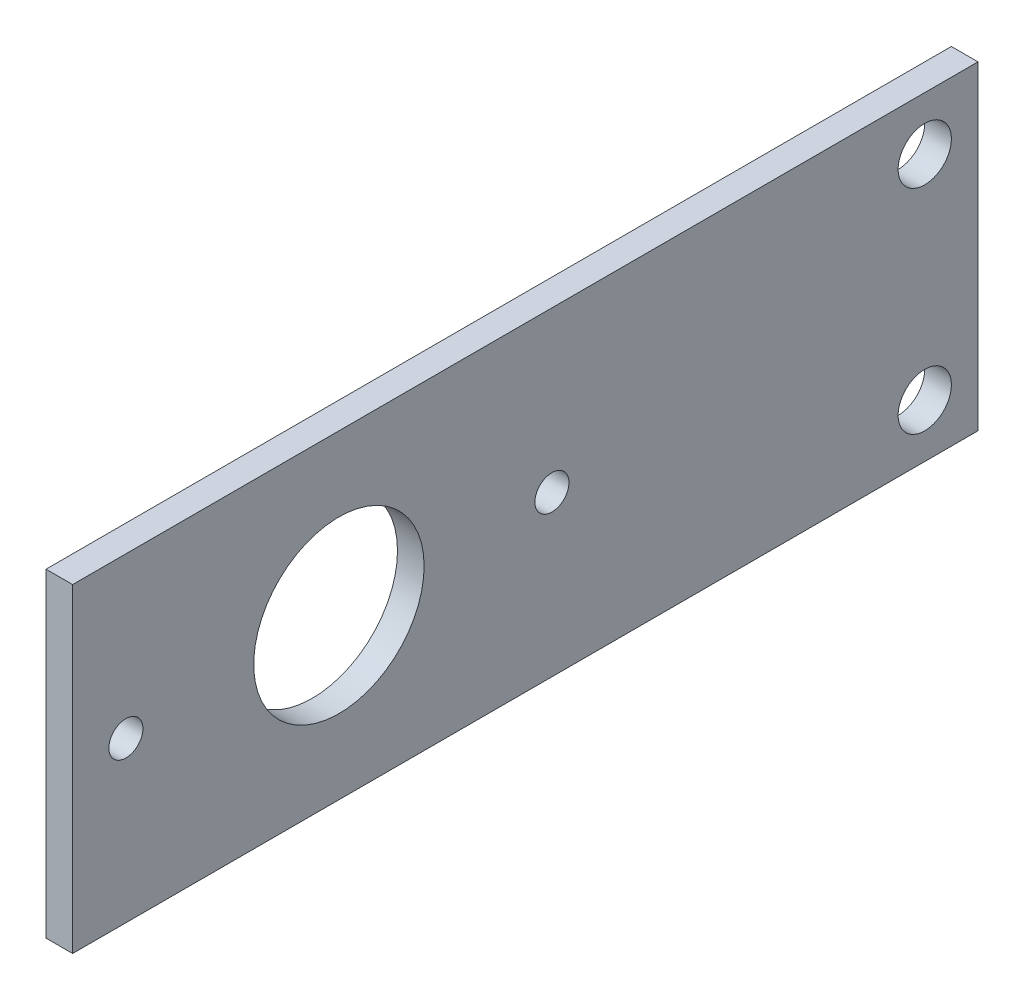
from build123d import *

# Parameters (mm, degrees)
SKETCH1_W           = 107.95
SKETCH1_H           = 38.1
SKETCH1_R           = 3.175
SKETCH1_R_2         = 2.032
SKETCH1_R_3         = 10.16
BOSS_EXTRUDE1_DEPTH = 3.175


with BuildPart() as part:
    # Sketch1 → Boss-Extrude1 (new body)
    with BuildSketch(Plane(origin=(0, 0, 0), x_dir=(0, 0, -1), z_dir=(1, 0, 0))):
        with Locations((-53.975, 19.05)):
            Rectangle(SKETCH1_W, SKETCH1_H)
        with Locations((-6.35, 31.75)):
            Circle(SKETCH1_R, mode=Mode.SUBTRACT)
        with Locations((-6.35, 6.35)):
            Circle(SKETCH1_R, mode=Mode.SUBTRACT)
        with Locations((-50.8, 19.05)):
            Circle(SKETCH1_R_2, mode=Mode.SUBTRACT)
        with Locations((-76.2, 19.05)):
            Circle(SKETCH1_R_3, mode=Mode.SUBTRACT)
        with Locations((-101.6, 19.05)):
            Circle(SKETCH1_R_2, mode=Mode.SUBTRACT)
    extrude(amount=BOSS_EXTRUDE1_DEPTH)


solid = part.part
